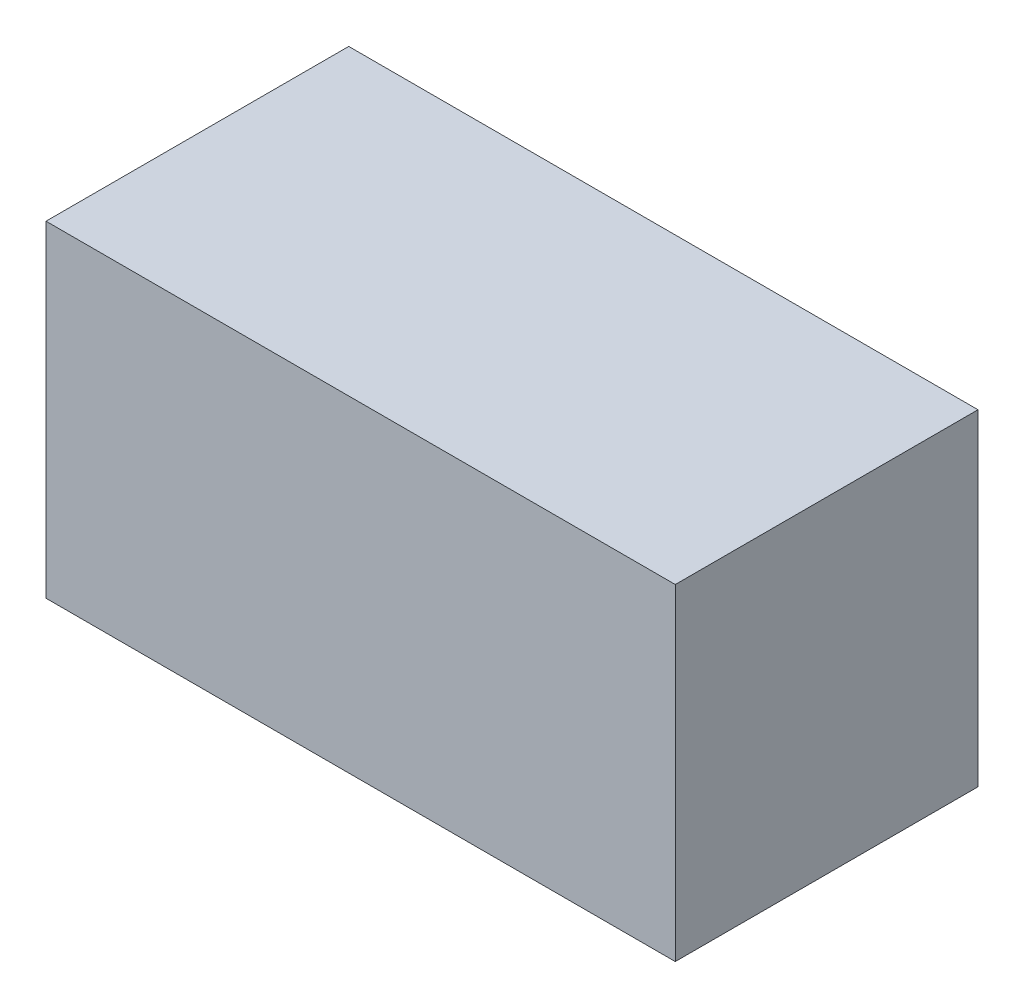
from build123d import *

# Parameters (mm, degrees)
SKETCH1_W               = 5.2799996
SKETCH1_H               = 2.7399996
COMPONENT_OUTLINE_DEPTH = 2.54


with BuildPart() as part:
    # Sketch1 → Component_Outline (new body)
    with BuildSketch(Plane.XY):
        with Locations((1.27, 0)):
            Rectangle(SKETCH1_W, SKETCH1_H)
    extrude(amount=COMPONENT_OUTLINE_DEPTH)


solid = part.part
